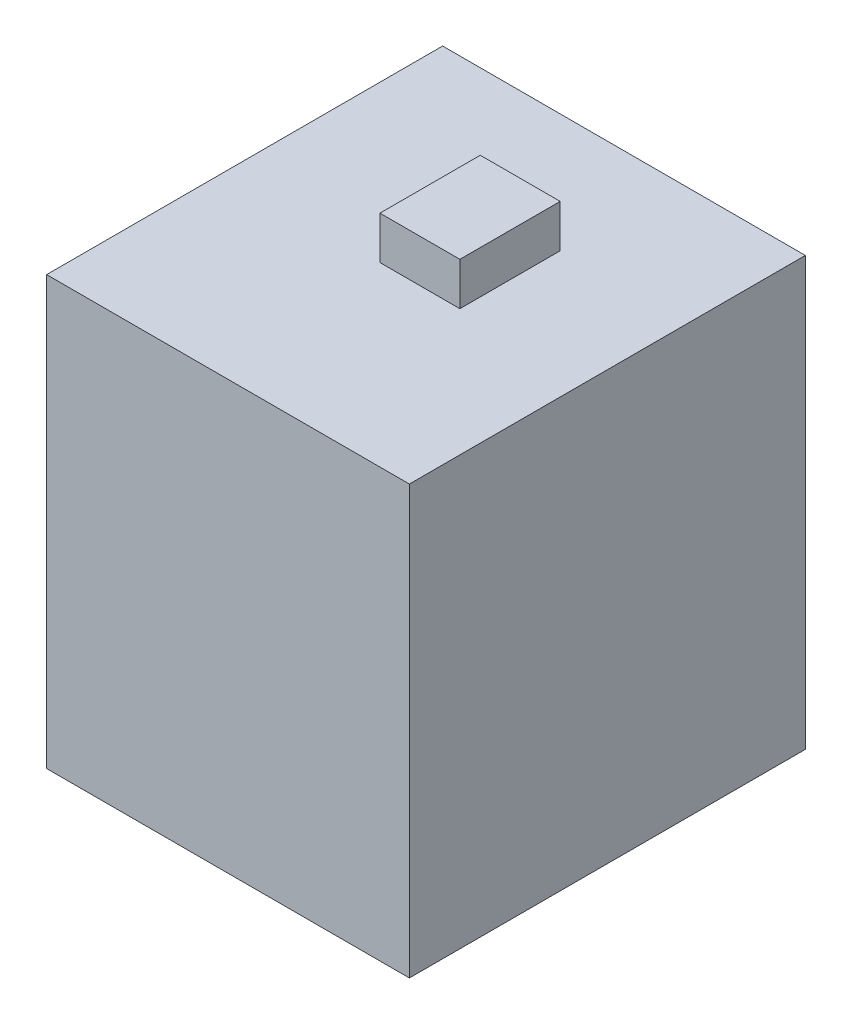
from build123d import *

# Parameters (mm, degrees)
SKETCH1_W           = 84.793949934
SKETCH1_H           = 92.563029117
BOSS_EXTRUDE1_DEPTH = 100
SKETCH2_W           = 18.682701967
SKETCH2_H           = 23.449765924
BOSS_EXTRUDE2_DEPTH = 10


with BuildPart() as part:
    # Sketch1 → Boss-Extrude1 (new body)
    with BuildSketch(Plane(origin=(0, 0, 0), x_dir=(1, 0, 0), z_dir=(0, 1, 0))):
        with Locations((5.88230281, 4.8834212)):
            Rectangle(SKETCH1_W, SKETCH1_H)
    extrude(amount=BOSS_EXTRUDE1_DEPTH)

    # Sketch2 → Boss-Extrude2 (add)
    with BuildSketch(Plane(origin=(0, 100, 0), x_dir=(1, 0, 0), z_dir=(0, 1, 0))):
        with Locations((9.341350983, 11.724882962)):
            Rectangle(SKETCH2_W, SKETCH2_H)
    extrude(amount=BOSS_EXTRUDE2_DEPTH)


solid = part.part
